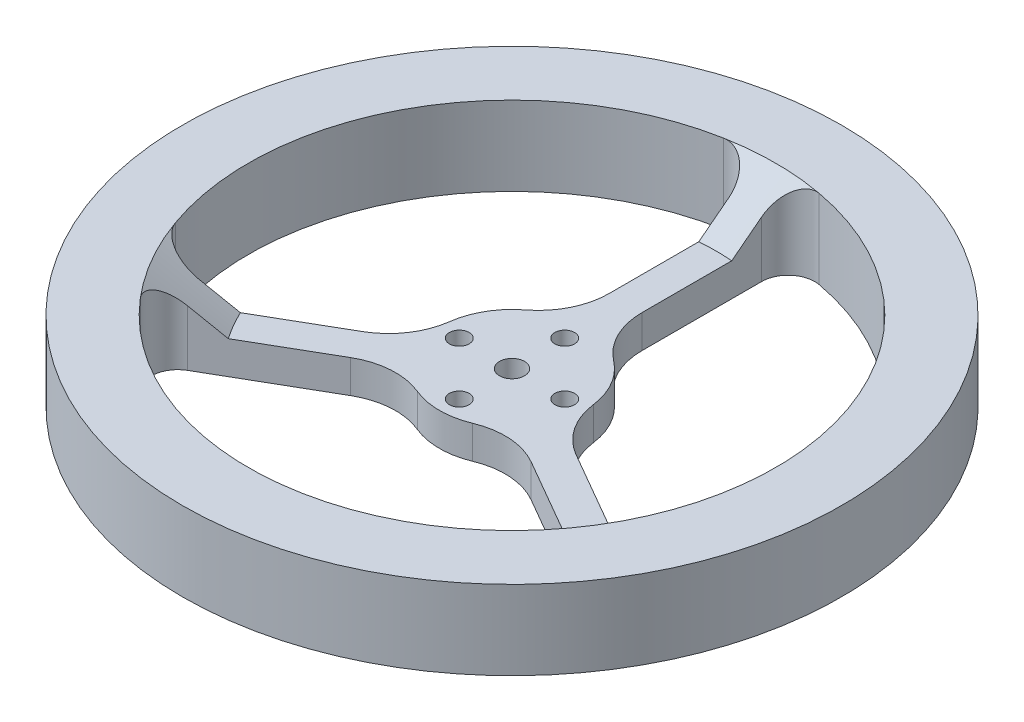
from build123d import *

# Parameters (mm, degrees)
SKETCH1_R           = 50
SKETCH1_R_2         = 1.9
BOSS_EXTRUDE1_DEPTH = 12
CUT_EXTRUDE5_DEPTH  = 12
SKETCH8_R           = 1.5
CUT_EXTRUDE8_DEPTH  = 10


with BuildPart() as part:
    # Sketch1 → Boss-Extrude1 (new body)
    with BuildSketch(Plane(origin=(0, 0, 0), x_dir=(1, 0, 0), z_dir=(0, 1, 0))):
        with Locations(Location((0, 0, 0), (0, 0, 270))):
            Circle(SKETCH1_R)
        with Locations(Location((0, 0, 0), (0, 0, 270))):
            Circle(SKETCH1_R_2, mode=Mode.SUBTRACT)
    extrude(amount=BOSS_EXTRUDE1_DEPTH)

    # Sketch3 → Cut-Extrude5 (cut)
    with BuildSketch(Plane(origin=(0, 12, 0), x_dir=(1, 0, 0), z_dir=(0, 1, 0))):
        with BuildLine():
            ThreePointArc((-4.207984423, -10.16330985), (-9.0163955, -9.369996887), (-13.679908421, -10.784850156))
            Line((-13.679908421, -10.784850156), (-29.375319677, -19.846600069))
            ThreePointArc((-29.375319677, -19.846600069), (-31.335687043, -22.658660307), (-30.427937323, -25.964218268))
            ThreePointArc((-30.427937323, -25.964218268), (0, -40), (30.427937323, -25.964218268))
            ThreePointArc((30.427937323, -25.964218268), (31.335687043, -22.658660307), (29.375319677, -19.846600069))
            Line((29.375319677, -19.846600069), (13.679908421, -10.784850156))
            ThreePointArc((13.679908421, -10.784850156), (9.0163955, -9.369996887), (4.207984423, -10.16330985))
            ThreePointArc((4.207984423, -10.16330985), (0, -11), (-4.207984423, -10.16330985))
        make_face()
        with BuildLine():
            ThreePointArc((-6.697692305, 8.725876334), (-3.606457588, 12.493425997), (-2.5, 17.239573292))
            Line((-2.5, 17.239573292), (-2.5, 35.363073119))
            ThreePointArc((-2.5, 35.363073119), (-3.95513192, 38.466831178), (-7.271703949, 39.33347584))
            ThreePointArc((-7.271703949, 39.33347584), (-34.641016151, 20), (-37.699641271, -13.369257572))
            ThreePointArc((-37.699641271, -13.369257572), (-35.290818963, -15.808170871), (-31.875319677, -15.51647305))
            Line((-31.875319677, -15.51647305), (-16.179908421, -6.454723137))
            ThreePointArc((-16.179908421, -6.454723137), (-12.622853088, -3.12342911), (-10.905676728, 1.437433516))
            ThreePointArc((-10.905676728, 1.437433516), (-9.526279442, 5.5), (-6.697692305, 8.725876334))
        make_face()
        with BuildLine():
            Line((2.5, 35.363073119), (2.5, 17.239573292))
            ThreePointArc((2.5, 17.239573292), (3.606457588, 12.493425997), (6.697692305, 8.725876334))
            ThreePointArc((6.697692305, 8.725876334), (9.526279442, 5.5), (10.905676728, 1.437433516))
            ThreePointArc((10.905676728, 1.437433516), (12.622853088, -3.12342911), (16.179908421, -6.454723137))
            Line((16.179908421, -6.454723137), (31.875319677, -15.51647305))
            ThreePointArc((31.875319677, -15.51647305), (35.290818963, -15.808170871), (37.699641271, -13.369257572))
            ThreePointArc((37.699641271, -13.369257572), (39.420715689, -6.782858879), (40, 0))
            ThreePointArc((40, 0), (30.747911782, 25.584485944), (7.271703949, 39.33347584))
            ThreePointArc((7.271703949, 39.33347584), (3.95513192, 38.466831178), (2.5, 35.363073119))
        make_face()
    extrude(amount=-CUT_EXTRUDE5_DEPTH, mode=Mode.SUBTRACT)

    # Sketch7 → Cut-Revolve1 (revolve, cut)
    with BuildSketch(Plane.XY):
        Polygon((40, 12), (30.939044017, 5), (0, 5), (0, 12), align=None)
    revolve(axis=Axis((0, 5, 0), (0, 1, 0)), mode=Mode.SUBTRACT)

    # Sketch8 → Cut-Extrude8 (cut)
    with BuildSketch(Plane(origin=(0, 0, 0), x_dir=(1, 0, 0), z_dir=(0, 1, 0))):
        with Locations((0, 8)):
            Circle(SKETCH8_R)
        with Locations((8, 0)):
            Circle(SKETCH8_R)
        with Locations((0, -8)):
            Circle(SKETCH8_R)
        with Locations((-8, 0)):
            Circle(SKETCH8_R)
    extrude(amount=CUT_EXTRUDE8_DEPTH, mode=Mode.SUBTRACT)


solid = part.part
